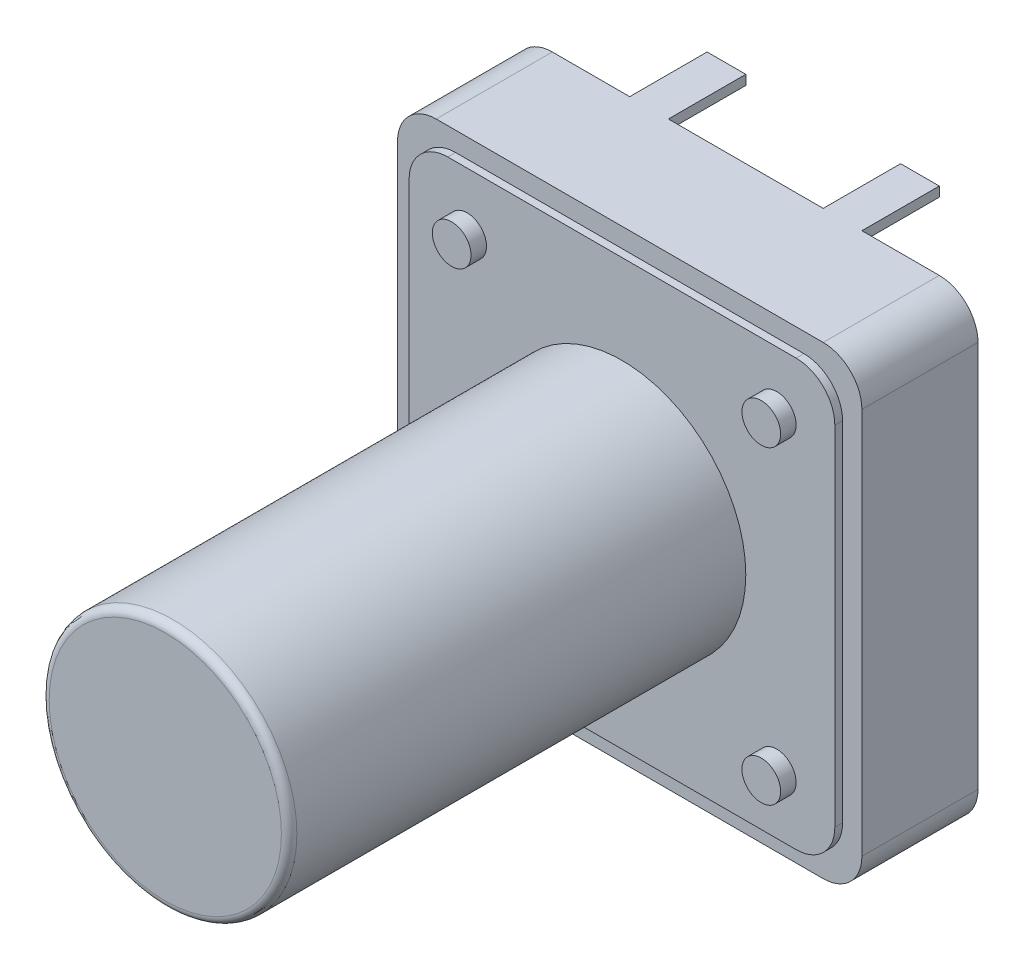
from build123d import *

# Parameters (mm, degrees)
EXTRUDE_1_DEPTH = 3
SKETCH_2_R      = 3.2
EXTRUDE_2_DEPTH = 12
FILLET_1_R      = 0.2
EXTRUDE_3_DEPTH = 0.2
SKETCH_4_R      = 0.5
EXTRUDE_4_DEPTH = 0.4
SKETCH_5_W      = 1
SKETCH_5_H      = 0.25
EXTRUDE_5_DEPTH = 2


with BuildPart() as part:
    # 草图1 → 凸台-拉伸1 (new body)
    with BuildSketch(Plane.XY):
        with BuildLine():
            Line((1, 0), (11, 0))
            ThreePointArc((11, 0), (11.707106781, -0.292893219), (12, -1))
            Line((12, -1), (12, -11))
            ThreePointArc((12, -11), (11.707106781, -11.707106781), (11, -12))
            Line((11, -12), (1, -12))
            ThreePointArc((1, -12), (0.292893219, -11.707106781), (0, -11))
            Line((0, -11), (0, -1))
            ThreePointArc((0, -1), (0.292893219, -0.292893219), (1, 0))
        make_face()
    extrude(amount=EXTRUDE_1_DEPTH)

    # 草图2 → 凸台-拉伸2 (add)
    with BuildSketch(Plane.XY.offset(3)):
        with Locations(Location((6, -6, 0), (0, 0, 180))):
            Circle(SKETCH_2_R)
    extrude(amount=EXTRUDE_2_DEPTH)

    # 圆角1
    fillet_1_edges = [part.edges().sort_by_distance(p)[0] for p in [
        (9.2, -6, 15),
    ]]
    fillet(fillet_1_edges, radius=FILLET_1_R)

    # 草图3 → 凸台-拉伸3 (add)
    with BuildSketch(Plane.XY.offset(3)):
        with BuildLine():
            Line((1.5, -0.5), (10.5, -0.5))
            ThreePointArc((10.5, -0.5), (11.207106781, -0.792893219), (11.5, -1.5))
            Line((11.5, -1.5), (11.5, -10.5))
            ThreePointArc((11.5, -10.5), (11.207106781, -11.207106781), (10.5, -11.5))
            Line((10.5, -11.5), (1.5, -11.5))
            ThreePointArc((1.5, -11.5), (0.792893219, -11.207106781), (0.5, -10.5))
            Line((0.5, -10.5), (0.5, -1.5))
            ThreePointArc((0.5, -1.5), (0.792893219, -0.792893219), (1.5, -0.5))
        make_face()
    extrude(amount=EXTRUDE_3_DEPTH)

    # 草图4 → 凸台-拉伸4 (add)
    with BuildSketch(Plane.XY.offset(3.2)):
        with Locations((2, -2)):
            Circle(SKETCH_4_R)
        with Locations(Location((10, -2, 0), (0, 0, 180))):
            Circle(SKETCH_4_R)
        with Locations((10, -10)):
            Circle(SKETCH_4_R)
        with Locations(Location((2, -10, 0), (0, 0, 180))):
            Circle(SKETCH_4_R)
    extrude(amount=EXTRUDE_4_DEPTH)

    # 草图5 → 凸台-拉伸5 (add)
    with BuildSketch(Plane(origin=(0, 0, 0), x_dir=(-1, 0, 0), z_dir=(0, 0, -1))):
        with Locations((-3.5, -11.875)):
            Rectangle(SKETCH_5_W, SKETCH_5_H)
        with Locations((-8.5, -11.875)):
            Rectangle(SKETCH_5_W, SKETCH_5_H)
        with Locations((-8.5, -0.125)):
            Rectangle(SKETCH_5_W, SKETCH_5_H)
        with Locations((-3.5, -0.125)):
            Rectangle(SKETCH_5_W, SKETCH_5_H)
    extrude(amount=EXTRUDE_5_DEPTH)


solid = part.part
